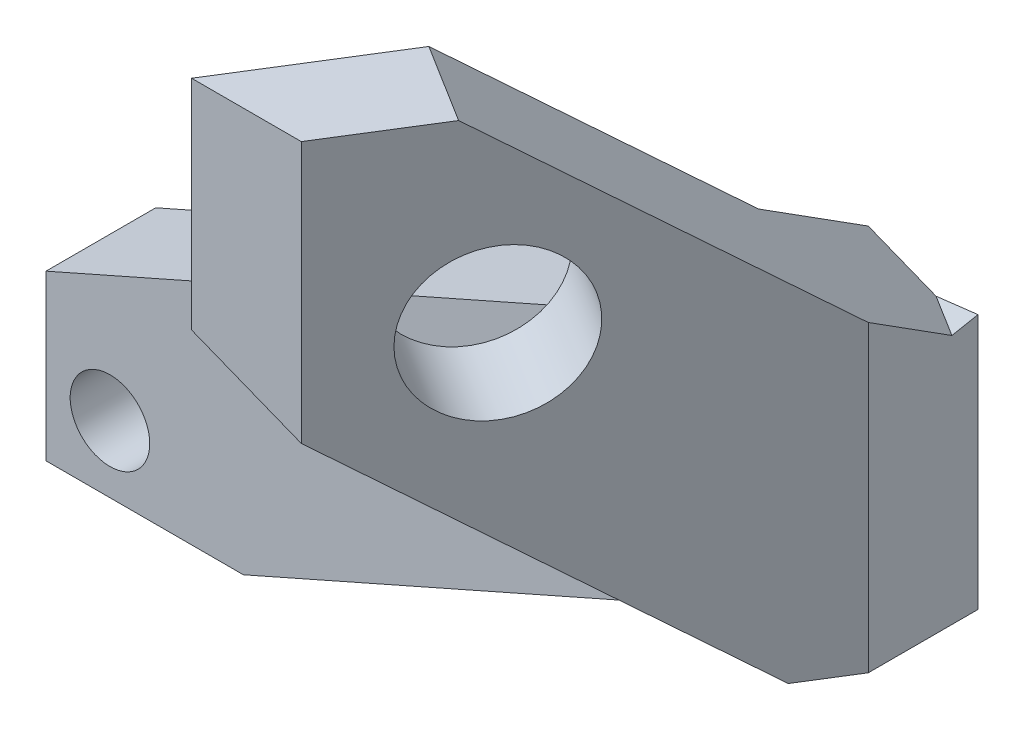
from build123d import *

# Parameters (mm, degrees)
SKICA1_R                 = 1.45
SKICA1_W                 = 4
SKICA1_H                 = 9.16588566
P_IDAT_VYSUNUT_M1_DEPTH  = 4
SKICA3_W                 = 4
SKICA3_H                 = 9.16588566
P_IDAT_VYSUNUT_M2_DEPTH  = 15
P_IDAT_VYSUNUT_M3_DEPTH  = 10
ODEBRAT_VYSUNUT_M2_DEPTH = 10
ODEBRAT_VYSUNUT_M3_DEPTH = 10
SKICA8_R                 = 2.75
ODEBRAT_VYSUNUT_M4_DEPTH = 10


with BuildPart() as part:
    # Skica1 → Přidat vysunutím1 (new body)
    # profile 1 of 2: a face of its own
    with BuildSketch(Plane.XY):
        Polygon((-7.778084737, -9.503012675), (-14.971883786, -9.503012675), (-14.971883786, -3.51452671), (11, 7.956888472), (11, -1.208997188), align=None)
        with Locations((-12.640965682, -7.067935851)):
            Circle(SKICA1_R, mode=Mode.SUBTRACT)
    # profile 2 of 2: a face of its own
    with BuildSketch(Plane.XY):
        with Locations((13, 3.373945642)):
            Rectangle(SKICA1_W, SKICA1_H)
    extrude(amount=P_IDAT_VYSUNUT_M1_DEPTH)

    # Skica3 → Přidat vysunutím2 (add, along a direction that is not the sketch's normal)
    with BuildSketch(Plane.XY.offset(4)):
        with Locations((13, 3.373945642)):
            Rectangle(SKICA3_W, SKICA3_H)
    extrude(amount=P_IDAT_VYSUNUT_M2_DEPTH, dir=(-0.5290758851456407, 0, 0.8485745151472301))

    # Skica5 → Přidat vysunutím3 (add)
    with BuildSketch(Plane(origin=(0, 7.956888472, 0), x_dir=(1, 0, 0), z_dir=(0, 1, 0))):
        Polygon((15, 0), (11, 0), (11, -4), (3.063861723, -16.728617727), (7.063861723, -16.728617727), (15, -4), align=None)
    extrude(amount=P_IDAT_VYSUNUT_M3_DEPTH)

    # Skica6 → Odebrat vysunutím2 (cut)
    with BuildSketch(Plane(origin=(9.716707036, 0, 6.058248609), x_dir=(-0.5290758851456409, 0, 0.8485745151472303), z_dir=(-0.8485745151472303, 0, -0.5290758851456409))):
        Polygon((-2.425536676, -1.208997188), (12.574463324, 10.009598213), (12.574463324, 17.956888472), (6.296672199, 17.956888472), (-7.12800363, 7.916488038), (-11.684978048, 8.945304904), (-10.179922277, 18.63037402), (-8.967516239, 18.63037402), (19.168665262, 18.63037402), (19.670350519, -6.557900971), (0.480889436, -6.557900971), align=None)
    extrude(amount=-ODEBRAT_VYSUNUT_M2_DEPTH, mode=Mode.SUBTRACT)

    # Skica7 → Odebrat vysunutím3 (cut)
    with BuildSketch(Plane(origin=(9.716707036, 0, 6.058248609), x_dir=(0.5290758851456409, 0, -0.8485745151472303), z_dir=(0.8485745151472303, 0, 0.5290758851456409))):
        Polygon((2.425536676, 17.956888472), (2.425536676, 11.433492981), (7.12800363, 7.916488038), (7.139324244, 7.919043865), (7.139324244, 17.956888472), align=None)
    extrude(amount=-ODEBRAT_VYSUNUT_M3_DEPTH, mode=Mode.SUBTRACT)

    # Skica8 → Odebrat vysunutím4 (cut)
    with BuildSketch(Plane(origin=(9.716707036, 0, 6.058248609), x_dir=(-0.5290758851456409, 0, 0.8485745151472303), z_dir=(-0.8485745151472303, 0, -0.5290758851456409))):
        with Locations((5.257931739, 11.090596363)):
            Circle(SKICA8_R)
    extrude(amount=-ODEBRAT_VYSUNUT_M4_DEPTH, mode=Mode.SUBTRACT)


solid = part.part
